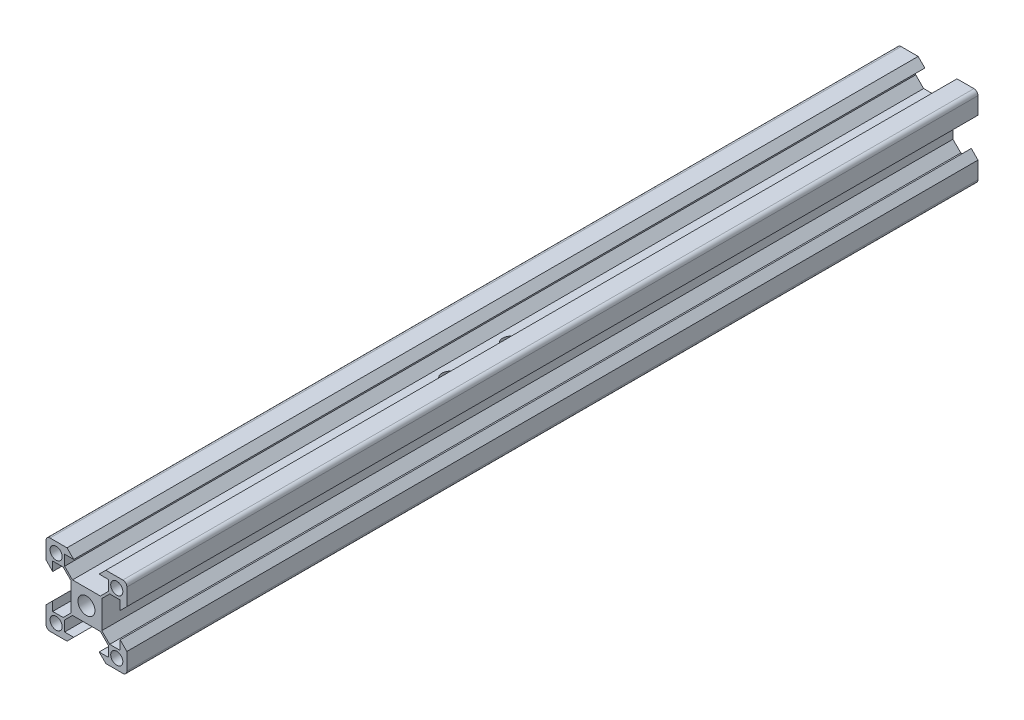
from build123d import *

# Parameters (mm, degrees)
SKETCH_1_R               = 1.5
SKETCH_1_R_2             = 2.1
EXTRUDE_1_DEPTH          = 105.25
FILLET_1_R               = 1
CUT_EXTRUDE_1_DEPTH      = 107.620835206
CUT_EXTRUDE_1_DEPTH_BACK = 107.620835206
SKETCH_2_R               = 2.05


with BuildPart() as part:
    # 草图1 → 凸台-拉伸1 (new, symmetric)
    with BuildSketch(Plane.XY):
        Polygon((-10, 10), (-10, 4.8), (-8.34, 3.14), (-8.34, 5.4), (-5.753553391, 5.4), (-3.8, 3.446446609), (-3.8, -3.446446609), (-5.753553391, -5.4), (-8.34, -5.4), (-8.34, -3.14), (-10, -4.8), (-10, -10), (-4.8, -10), (-3.14, -8.34), (-5.4, -8.34), (-5.4, -5.753553391), (-3.446446609, -3.8), (3.446446609, -3.8), (5.4, -5.753553391), (5.4, -8.34), (3.14, -8.34), (4.8, -10), (10, -10), (10, -4.8), (8.34, -3.14), (8.34, -5.4), (5.753553391, -5.4), (3.8, -3.446446609), (3.8, 3.446446609), (5.753553391, 5.4), (8.34, 5.4), (8.34, 3.14), (10, 4.8), (10, 10), (4.8, 10), (3.14, 8.34), (5.4, 8.34), (5.4, 5.753553391), (3.446446609, 3.8), (-3.446446609, 3.8), (-5.4, 5.753553391), (-5.4, 8.34), (-3.14, 8.34), (-4.8, 10), align=None)
        with Locations(Location((-7.5, 7.5, 0), (0, 0, 180))):
            Circle(SKETCH_1_R, mode=Mode.SUBTRACT)
        with Locations(Location((0, 0, 0), (0, 0, 180))):
            Circle(SKETCH_1_R_2, mode=Mode.SUBTRACT)
        with Locations(Location((-7.5, -7.5, 0), (0, 0, 180))):
            Circle(SKETCH_1_R, mode=Mode.SUBTRACT)
        with Locations(Location((7.5, -7.5, 0), (0, 0, 180))):
            Circle(SKETCH_1_R, mode=Mode.SUBTRACT)
        with Locations(Location((7.5, 7.5, 0), (0, 0, 180))):
            Circle(SKETCH_1_R, mode=Mode.SUBTRACT)
    extrude(amount=EXTRUDE_1_DEPTH, both=True)

    # 圆角1
    fillet_1_edges = [part.edges().sort_by_distance(p)[0] for p in [
        (10, 10, 0),
        (10, -10, 0),
        (-10, -10, 0),
        (-10, 10, 0),
    ]]
    fillet(fillet_1_edges, radius=FILLET_1_R)

    # 草图2 → 切除-拉伸1 (cut, two sides: drawn at the far end of the back side and taken through both)
    with BuildSketch(Plane(origin=(0, 3.8, 0), x_dir=(1, 0, 0), z_dir=(0, 1, 0)).offset(-CUT_EXTRUDE_1_DEPTH_BACK)):
        with Locations(Location((0, -15.25, 0), (0, 0, 270))):
            Circle(SKETCH_2_R)
        with Locations(Location((0, -0.25, 0), (0, 0, 270))):
            Circle(SKETCH_2_R)
    extrude(amount=CUT_EXTRUDE_1_DEPTH + CUT_EXTRUDE_1_DEPTH_BACK, mode=Mode.SUBTRACT)


solid = part.part
